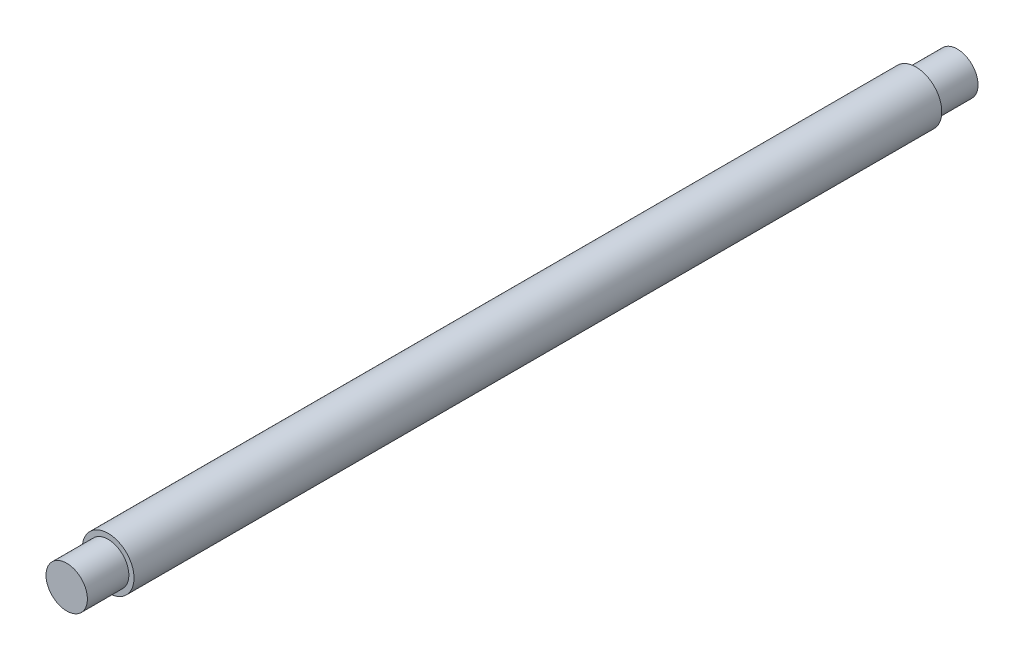
from build123d import *

# Parameters (mm, degrees)
SKETCH1_R           = 5
BOSS_EXTRUDE1_DEPTH = 172
SKETCH2_R           = 5
SKETCH2_R_2         = 4
CUT_EXTRUDE1_DEPTH  = 8


with BuildPart() as part:
    # Sketch1 → Boss-Extrude1 (new body)
    with BuildSketch(Plane.XY):
        Circle(SKETCH1_R)
    extrude(amount=BOSS_EXTRUDE1_DEPTH)

    # Sketch2 → Cut-Extrude1 (cut)
    with BuildSketch(Plane(origin=(0, 0, 0), x_dir=(-1, 0, 0), z_dir=(0, 0, -1))):
        Circle(SKETCH2_R)
        Circle(SKETCH2_R_2, mode=Mode.SUBTRACT)
    cut_extrude1 = extrude(amount=-CUT_EXTRUDE1_DEPTH, mode=Mode.SUBTRACT)

    # Mirror1: Cut-Extrude1 across plane
    add(cut_extrude1.mirror(Plane.XY.offset(86)), mode=Mode.SUBTRACT)


solid = part.part
